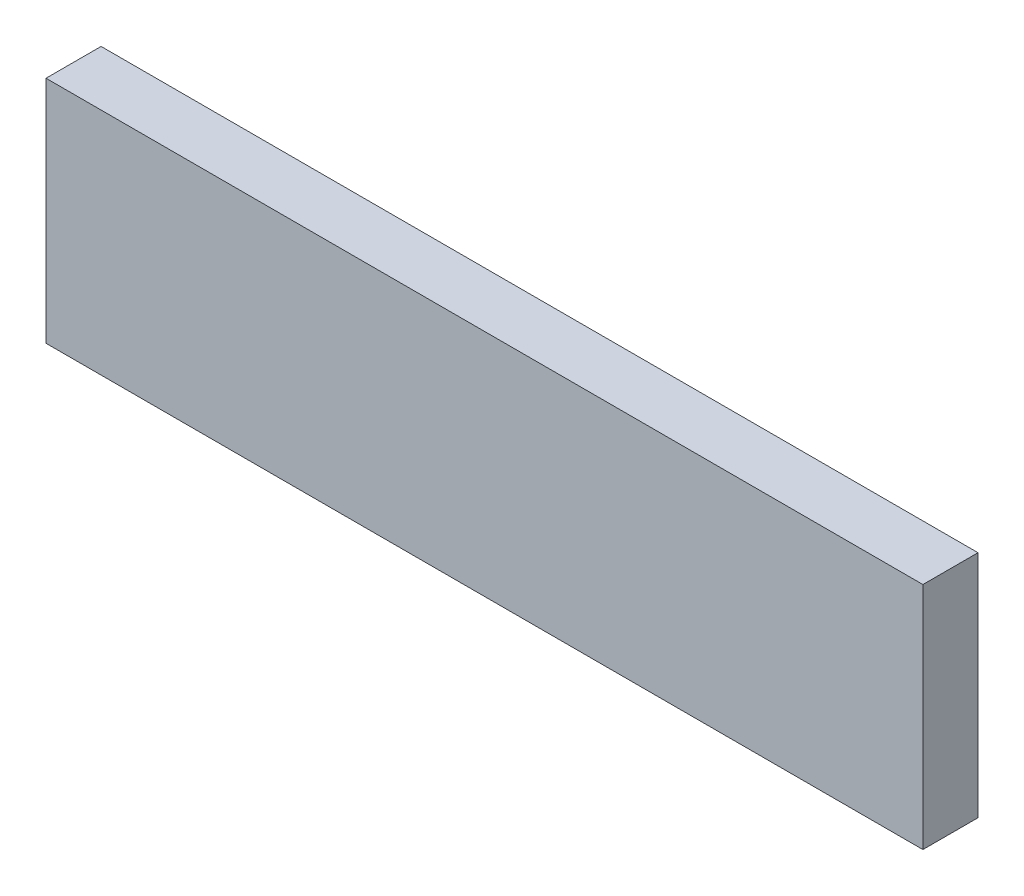
from build123d import *

# Parameters (mm, degrees)
ESBO_O1_W                = 191
ESBO_O1_H                = 50
RESSALTO_EXTRUS_O1_DEPTH = 6
ESBO_O4_R                = 3
CORTE_EXTRUS_O1_DEPTH    = 20


with BuildPart() as part:
    # Esboço1 → Ressalto-extrusão1 (new, symmetric)
    with BuildSketch(Plane.XY):
        Rectangle(ESBO_O1_W, ESBO_O1_H)
    extrude(amount=RESSALTO_EXTRUS_O1_DEPTH, both=True)

    # Esboço4 → Corte-extrusão1 (cut)
    with BuildSketch(Plane(origin=(0, -25, 0), x_dir=(-1, 0, 0), z_dir=(0, -1, 0))):
        with Locations(Location((75, 0, 0), (0, 0, 90))):
            Circle(ESBO_O4_R)
        with Locations(Location((-75, 0, 0), (0, 0, 90))):
            Circle(ESBO_O4_R)
    extrude(amount=-CORTE_EXTRUS_O1_DEPTH, mode=Mode.SUBTRACT)


solid = part.part
